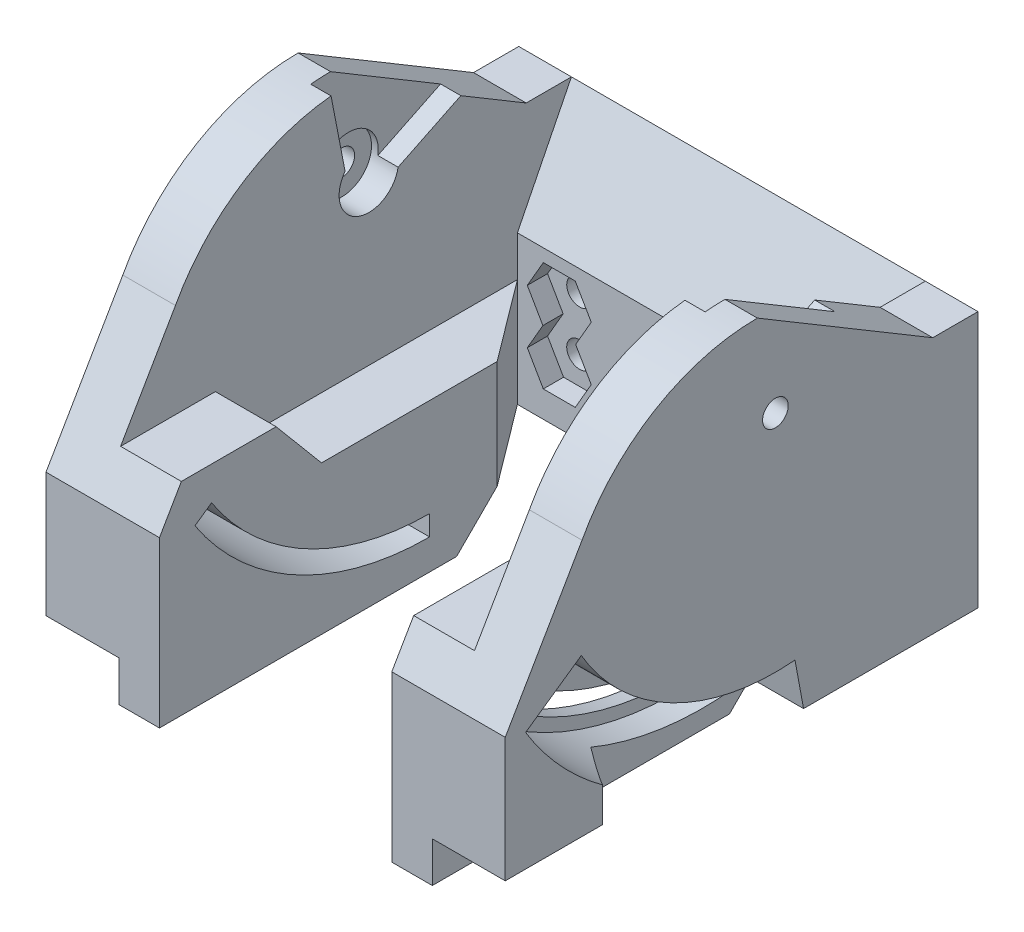
from build123d import *

# Parameters (mm, degrees)
CROQUIS1_W              = 34
CROQUIS1_H              = 19
SALIENTE_EXTRUIR1_DEPTH = 35
CROQUIS2_W              = 26.2
CROQUIS2_H              = 31
CORTAR_EXTRUIR1_DEPTH   = 25
CORTAR_EXTRUIR3_DEPTH   = 26.2
SALIENTE_EXTRUIR2_DEPTH = 34
CROQUIS10_W             = 26.2
CROQUIS10_H             = 25.966324345
CORTAR_EXTRUIR4_DEPTH   = 10
CROQUIS18_R             = 0.95
CORTAR_EXTRUIR11_DEPTH  = 4
CORTAR_EXTRUIR12_DEPTH  = 1.5
CORTAR_EXTRUIR14_START  = -34
CROQUIS21_R             = 0.95
CORTAR_EXTRUIR14_DEPTH  = 34
SALIENTE_EXTRUIR3_DEPTH = 8
CROQUIS25_W             = 3
CROQUIS25_H             = 25
SALIENTE_EXTRUIR4_DEPTH = 3
CROQUIS43_W             = 4.5
CROQUIS43_H             = 12
SALIENTE_EXTRUIR8_DEPTH = 4
CORTAR_EXTRUIR18_DEPTH  = 7.4
CORTAR_EXTRUIR16_START  = -34
CORTAR_EXTRUIR16_DEPTH  = 26.6
CORTAR_EXTRUIR20_START  = -1.5
CORTAR_EXTRUIR20_DEPTH  = 1.5
CORTAR_EXTRUIR21_DEPTH  = 27.7
CORTAR_EXTRUIR22_START  = -34
CORTAR_EXTRUIR22_DEPTH  = 34
CORTAR_EXTRUIR23_DEPTH  = 3
CROQUIS36_R             = 2.2
CORTAR_EXTRUIR24_DEPTH  = 2
CORTAR_EXTRUIR25_START  = 28.2
CROQUIS36_2_R           = 2.2
CORTAR_EXTRUIR25_DEPTH  = 28.2
CORTAR_EXTRUIR26_START  = -34
CORTAR_EXTRUIR26_DEPTH  = 34
CORTAR_EXTRUIR27_DEPTH  = 1
CORTAR_EXTRUIR28_START  = -23.2
CORTAR_EXTRUIR28_DEPTH  = 23.2
CORTAR_EXTRUIR29_DEPTH  = 26.2


with BuildPart() as part:
    # Croquis1 → Saliente-Extruir1 (new body)
    with BuildSketch(Plane.XY):
        with Locations((-31.887263086, 5.12254902)):
            Rectangle(CROQUIS1_W, CROQUIS1_H)
    extrude(amount=SALIENTE_EXTRUIR1_DEPTH)

    # Croquis2 → Cortar-Extruir1 (cut)
    with BuildSketch(Plane.XZ.offset(4.37745098)):
        with Locations((-31.887263086, 19.5)):
            Rectangle(CROQUIS2_W, CROQUIS2_H)
    extrude(amount=-CORTAR_EXTRUIR1_DEPTH, mode=Mode.SUBTRACT)

    # Croquis4 → Cortar-Extruir3 (cut)
    with BuildSketch(Plane.ZY.offset(18.787263086)):
        Polygon((4, 14.62254902), (4, 6.62254902), (0, 14.62254902), align=None)
    extrude(amount=CORTAR_EXTRUIR3_DEPTH, mode=Mode.SUBTRACT)

    # Croquis9 → Saliente-Extruir2 (add)
    with BuildSketch(Plane(origin=(-14.887263086, 0, 0), x_dir=(0, 0, -1), z_dir=(1, 0, 0))):
        with BuildLine():
            Line((-29.315831827, 14.62254902), (-3.349507482, 14.62254902))
            ThreePointArc((-3.349507482, 14.62254902), (-16.332669655, 22.37254902), (-29.315831827, 14.62254902))
        make_face()
    extrude(amount=-SALIENTE_EXTRUIR2_DEPTH)

    # Croquis10 → Cortar-Extruir4 (cut)
    with BuildSketch(Plane.XZ.offset(-14.62254902)):
        with Locations((-31.887263086, 16.332669655)):
            Rectangle(CROQUIS10_W, CROQUIS10_H)
    extrude(amount=-CORTAR_EXTRUIR4_DEPTH, mode=Mode.SUBTRACT)

    # Croquis18 → Cortar-Extruir11 (cut)
    with BuildSketch(Plane(origin=(0, 0, 0), x_dir=(-1, 0, 0), z_dir=(0, 0, -1))):
        with Locations((41.887263086, -0.37745098)):
            Circle(CROQUIS18_R)
        with Locations((21.887263086, -0.37745098)):
            Circle(CROQUIS18_R)
        with Locations((21.887263086, 3.62254902)):
            Circle(CROQUIS18_R)
        with Locations((41.887263086, 3.62254902)):
            Circle(CROQUIS18_R)
    extrude(amount=-CORTAR_EXTRUIR11_DEPTH, mode=Mode.SUBTRACT)

    # Croquis19 → Cortar-Extruir12 (cut)
    with BuildSketch(Plane.XY.offset(4)):
        Polygon((-39.520126982, -0.37745098), (-40.67482752, 1.62254902), (-39.520126982, 3.62254902), (-40.703695034, 5.67254902), (-43.070831137, 5.67254902), (-44.254399189, 3.62254902), (-43.099698651, 1.62254902), (-44.254399189, -0.37745098), (-43.070831137, -2.42745098), (-40.703695034, -2.42745098), align=None)
        Polygon((-19.520126982, -0.37745098), (-20.67482752, 1.62254902), (-19.520126982, 3.62254902), (-20.703695034, 5.67254902), (-23.070831137, 5.67254902), (-24.254399189, 3.62254902), (-23.099698651, 1.62254902), (-24.254399189, -0.37745098), (-23.070831137, -2.42745098), (-20.703695034, -2.42745098), align=None)
    extrude(amount=-CORTAR_EXTRUIR12_DEPTH, mode=Mode.SUBTRACT)

    # Croquis21 → Cortar-Extruir14 (cut)
    with BuildSketch(Plane(origin=(-14.887263086, 0, 0), x_dir=(0, 0, -1), z_dir=(1, 0, 0)).offset(CORTAR_EXTRUIR14_START)):
        with Locations((-15, 15.62254902)):
            Circle(CROQUIS21_R)
    extrude(amount=CORTAR_EXTRUIR14_DEPTH, mode=Mode.SUBTRACT)

    # Croquis23 → Saliente-Extruir3 (add)
    with BuildSketch(Plane.XZ.offset(4.37745098)):
        Polygon((-44.987263086, 35), (-40.487263086, 35), (-40.487263086, 10), (-44.987263086, 4), align=None)
        Polygon((-18.787263086, 35), (-23.287263086, 35), (-23.287263086, 10), (-18.787263086, 4), align=None)
    extrude(amount=-SALIENTE_EXTRUIR3_DEPTH)

    # Croquis25 → Saliente-Extruir4 (add)
    with BuildSketch(Plane.XZ.offset(4.37745098)):
        with Locations((-41.987263086, 22.5)):
            Rectangle(CROQUIS25_W, CROQUIS25_H)
        with Locations((-21.787263086, 22.5)):
            Rectangle(CROQUIS25_W, CROQUIS25_H)
    extrude(amount=SALIENTE_EXTRUIR4_DEPTH)

    # Croquis43 → Saliente-Extruir8 (add)
    with BuildSketch(Plane(origin=(0, 3.62254902, 0), x_dir=(1, 0, 0), z_dir=(0, 1, 0))):
        with Locations((-21.037263086, -29)):
            Rectangle(CROQUIS43_W, CROQUIS43_H)
        with Locations((-42.737263086, -29)):
            Rectangle(CROQUIS43_W, CROQUIS43_H)
    extrude(amount=SALIENTE_EXTRUIR8_DEPTH)

    # Croquis27 → Cortar-Extruir18 (cut)
    with BuildSketch(Plane(origin=(-14.887263086, 0, 0), x_dir=(0, 0, -1), z_dir=(1, 0, 0))):
        with BuildLine():
            Line((-13.549434023, -0.942577786), (-12.635457129, -5.887329478))
            ThreePointArc((-12.635457129, -5.887329478), (-24.560215782, -3.790544761), (-33.492032026, 4.383746258))
            Line((-33.492032026, 4.383746258), (-29.371216121, 7.25740019))
            ThreePointArc((-29.371216121, 7.25740019), (-22.651516826, 0.859017666), (-13.549434023, -0.942577786))
        make_face()
    extrude(amount=-CORTAR_EXTRUIR18_DEPTH, mode=Mode.SUBTRACT)

    # Croquis24 → Cortar-Extruir16 (cut)
    with BuildSketch(Plane(origin=(-14.887263086, 0, 0), x_dir=(0, 0, -1), z_dir=(1, 0, 0)).offset(CORTAR_EXTRUIR16_START)):
        with BuildLine():
            Line((-15, -3.62745098), (-15, -5.12726591))
            ThreePointArc((-15, -5.12726591), (-24.876851848, -2.625810281), (-32.372332418, 4.275439874))
            Line((-32.372332418, 4.275439874), (-31.142668885, 5.135569413))
            ThreePointArc((-31.142668885, 5.135569413), (-24.183902835, -1.295442254), (-15, -3.62745098))
        make_face()
    extrude(amount=CORTAR_EXTRUIR16_DEPTH, mode=Mode.SUBTRACT)

    # Croquis29 → Cortar-Extruir20 (cut)
    with BuildSketch(Plane.ZY.offset(18.787263086).offset(CORTAR_EXTRUIR20_START)):
        with BuildLine():
            Line((17.797402962, 22.299641931), (16.5, 15.62254902))
            ThreePointArc((16.5, 15.62254902), (15.426958984, 14.184596995), (13.743058632, 14.803953638))
            Line((13.743058632, 14.803953638), (6.296886003, 18.432060872))
            ThreePointArc((6.296886003, 18.432060872), (11.631045274, 21.603150873), (17.797402962, 22.299641931))
        make_face()
    extrude(amount=CORTAR_EXTRUIR20_DEPTH, mode=Mode.SUBTRACT)

    # Croquis29<2> → Cortar-Extruir21 (cut)
    with BuildSketch(Plane.ZY.offset(18.787263086)):
        with BuildLine():
            Line((17.797402962, 22.299641931), (16.5, 15.62254902))
            ThreePointArc((16.5, 15.62254902), (15.426958984, 14.184596995), (13.743058632, 14.803953638))
            Line((13.743058632, 14.803953638), (6.296886003, 18.432060872))
            ThreePointArc((6.296886003, 18.432060872), (11.631045274, 21.603150873), (17.797402962, 22.299641931))
        make_face()
    extrude(amount=CORTAR_EXTRUIR21_DEPTH, mode=Mode.SUBTRACT)

    # Croquis30 → Cortar-Extruir22 (cut)
    with BuildSketch(Plane.ZY.offset(48.887263086).offset(CORTAR_EXTRUIR22_START)):
        Polygon((29.315831827, 14.62254902), (35, 4.827802707), (35, 14.62254902), align=None)
    extrude(amount=CORTAR_EXTRUIR22_DEPTH, mode=Mode.SUBTRACT)

    # Croquis35 → Cortar-Extruir23 (cut)
    with BuildSketch(Plane.XZ.offset(4.37745098)):
        Polygon((-20.287263086, 23.262320252), (-14.887263086, 23.262320252), (-14.887263086, 27.796275801), align=None)
    extrude(amount=-CORTAR_EXTRUIR23_DEPTH, mode=Mode.SUBTRACT)

    # Croquis36 → Cortar-Extruir24 (cut)
    with BuildSketch(Plane.ZY.offset(18.787263086)):
        with Locations((15, 15.62254902)):
            Circle(CROQUIS36_R)
    extrude(amount=-CORTAR_EXTRUIR24_DEPTH, mode=Mode.SUBTRACT)

    # Croquis36<2> → Cortar-Extruir25 (cut)
    with BuildSketch(Plane.ZY.offset(18.787263086).offset(CORTAR_EXTRUIR25_START)):
        with Locations((15, 15.62254902)):
            Circle(CROQUIS36_2_R)
    extrude(amount=-CORTAR_EXTRUIR25_DEPTH, mode=Mode.SUBTRACT)

    # Croquis38 → Cortar-Extruir26 (cut)
    with BuildSketch(Plane.ZY.offset(48.887263086).offset(CORTAR_EXTRUIR26_START)):
        Polygon((3.349507482, 14.62254902), (16.332669655, 22.37254902), (3.349507482, 22.37254902), align=None)
    extrude(amount=CORTAR_EXTRUIR26_DEPTH, mode=Mode.SUBTRACT)

    # Croquis40 → Cortar-Extruir27 (cut)
    with BuildSketch(Plane.ZY.offset(48.887263086)):
        Polygon((24.462469518, 4.967906508), (27.804965088, 0.984475403), (27.192129534, 0.470245316), (23.849633963, 4.45367642), align=None)
        Polygon((23.499956861, 4.180731289), (26.48255433, -0.078859342), (25.827232695, -0.537720491), (22.844635226, 3.72187014), align=None)
        Polygon((22.469633136, 3.484764914), (25.069633136, -1.018567186), (24.376812813, -1.418567186), (21.776812813, 3.084764914), align=None)
        Polygon((21.381853505, 2.883100647), (23.579468466, -1.829699846), (22.854422236, -2.167794455), (20.656807275, 2.545006037), align=None)
    extrude(amount=-CORTAR_EXTRUIR27_DEPTH, mode=Mode.SUBTRACT)

    # Croquis41 → Cortar-Extruir28 (cut)
    with BuildSketch(Plane(origin=(-20.287263086, 0, 0), x_dir=(0, 0, -1), z_dir=(1, 0, 0)).offset(CORTAR_EXTRUIR28_START)):
        Polygon((-10, -4.37745098), (-10, -7.37745098), (-13, -7.37745098), align=None)
    extrude(amount=CORTAR_EXTRUIR28_DEPTH, mode=Mode.SUBTRACT)

    # Croquis44 → Cortar-Extruir29 (cut)
    with BuildSketch(Plane.ZY.offset(18.787263086)):
        Polygon((23, 7.62254902), (26.362551066, 7.62254902), (23, 3.62254902), align=None)
    extrude(amount=CORTAR_EXTRUIR29_DEPTH, mode=Mode.SUBTRACT)


solid = part.part
